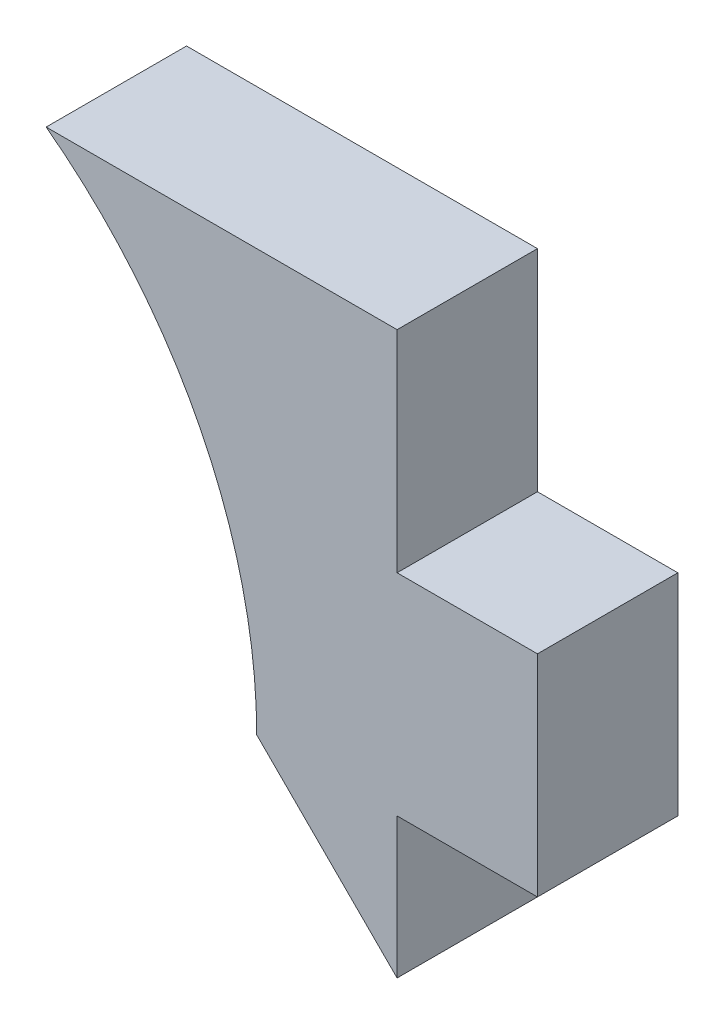
from build123d import *

# Parameters (mm, degrees)
BOSS_EXTRUDE1_DEPTH = 3


with BuildPart() as part:
    # Sketch1 → Boss-Extrude1 (new body)
    with BuildSketch(Plane.XY):
        with BuildLine():
            Line((494, 6), (494, 3))
            Line((494, 3), (491, 6))
            ThreePointArc((491, 6), (489.812305899, 11.031152949), (486.5, 15))
            Line((486.5, 15), (494, 15))
            Line((494, 15), (494, 10.5))
            Line((494, 10.5), (497, 10.5))
            Line((497, 10.5), (497, 6))
            Line((497, 6), (494, 6))
        make_face()
    extrude(amount=BOSS_EXTRUDE1_DEPTH)


solid = part.part
